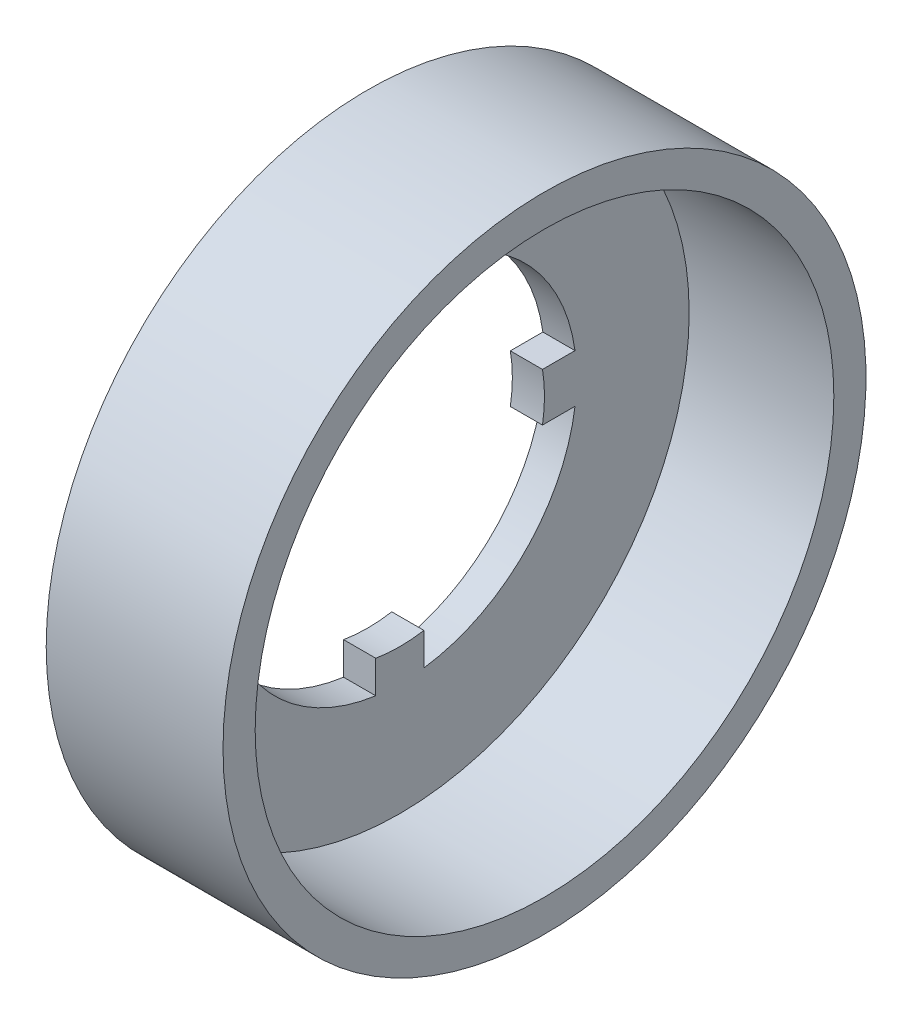
from build123d import *

# Parameters (mm, degrees)
ENL_V_MAT_EXTRU_1_DEPTH = 61.695963622


with BuildPart() as part:
    # Esquisse1 → Base-Révolution (revolve)
    with BuildSketch(Plane.XY, mode=Mode.PRIVATE) as base_r_volution_sk:
        Polygon((0, 40), (0, 18), (4, 18), (4, 36), (22, 36), (22, 40), align=None)
    revolve(base_r_volution_sk.sketch.rotate(Axis((0, 0, 0), (1, 0, 0)), 90), axis=Axis((0, 0, 0), (1, 0, 0)))

    # Esquisse2 → Enlèv. mat.-Extru.1 (cut, through all)
    with BuildSketch(Plane.ZY):
        with BuildLine():
            Line((-3, 16), (-3, 21.794494718))
            ThreePointArc((-3, 21.794494718), (-15.556349186, 15.556349186), (-21.794494718, 3))
            Line((-21.794494718, 3), (-16, 3))
            Line((-16, 3), (-16, -3))
            Line((-16, -3), (-21.794494718, -3))
            ThreePointArc((-21.794494718, -3), (-15.556349186, -15.556349186), (-3, -21.794494718))
            Line((-3, -21.794494718), (-3, -16))
            Line((-3, -16), (3, -16))
            Line((3, -16), (3, -21.794494718))
            ThreePointArc((3, -21.794494718), (15.556349186, -15.556349186), (21.794494718, -3))
            Line((21.794494718, -3), (16, -3))
            Line((16, -3), (16, 3))
            Line((16, 3), (21.794494718, 3))
            ThreePointArc((21.794494718, 3), (15.556349186, 15.556349186), (3, 21.794494718))
            Line((3, 21.794494718), (3, 16))
            Line((3, 16), (-3, 16))
        make_face()
    extrude(amount=-ENL_V_MAT_EXTRU_1_DEPTH, mode=Mode.SUBTRACT)


solid = part.part
